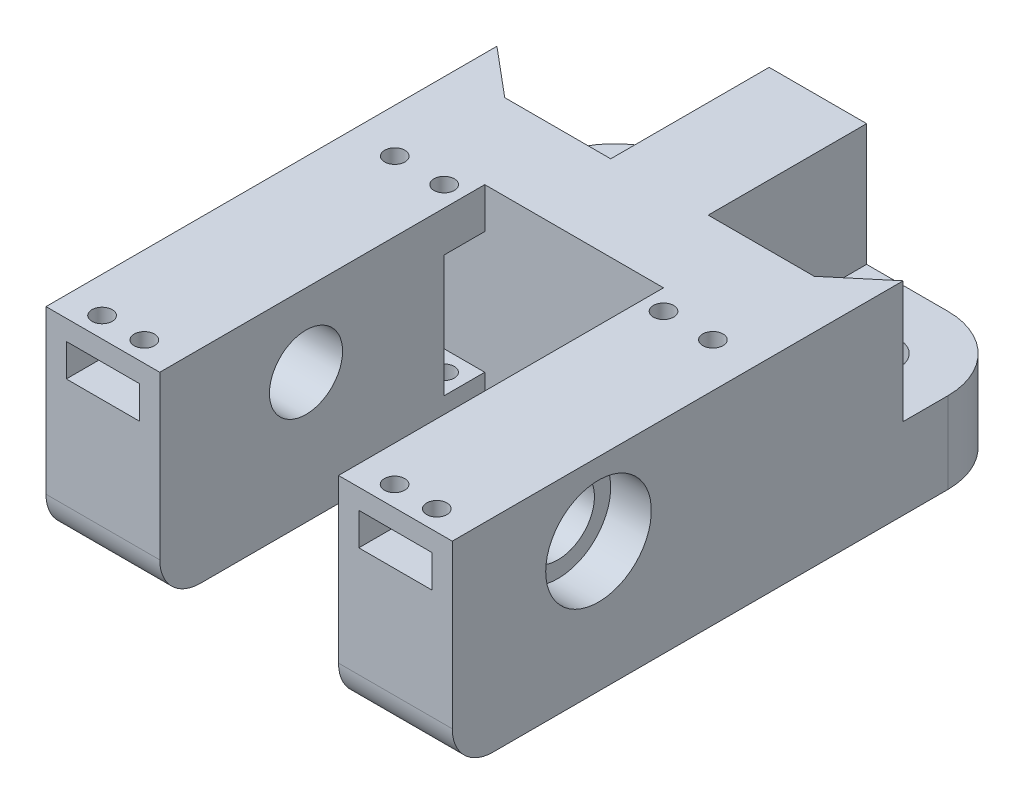
from build123d import *

# Parameters (mm, degrees)
SKETCH_1_W               = 50
SKETCH_1_H               = 25
EXTRUDE_1_DEPTH          = 70
SKETCH_2_W               = 22
SKETCH_2_H               = 25
CUT_EXTRUDE_1_DEPTH      = 40
SKETCH_3_R               = 4.5
CUT_EXTRUDE_2_DEPTH      = 50
SKETCH_4_R               = 6.5
CUT_EXTRUDE_4_DEPTH      = 5
SKETCH_5_R               = 3
CUT_EXTRUDE_5_DEPTH      = 29
CUT_EXTRUDE_6_DEPTH      = 5
CUT_EXTRUDE_6_DEPTH_BACK = 15
SKETCH_7_W               = 5
SKETCH_7_H               = 15
CUT_EXTRUDE_7_DEPTH      = 10
CUT_EXTRUDE_START        = -10
SKETCH_8_R               = 1.25
CUT_EXTRUDE_8_DEPTH      = 40
SKETCH_9_R               = 2.75
CUT_EXTRUDE_9_DEPTH      = 3
FILLET_2_R               = 5
SKETCH_10_W              = 9
SKETCH_10_H              = 4
CUT_EXTRUDE_10_DEPTH     = 5
SKETCH_12_R              = 1.25
CUT_EXTRUDE_11_DEPTH     = 10


with BuildPart() as part:
    # 스케치1 → 보스-돌출1 (new body)
    with BuildSketch(Plane.XY):
        Rectangle(SKETCH_1_W, SKETCH_1_H)
    extrude(amount=EXTRUDE_1_DEPTH)

    # 스케치2 → 컷-돌출1 (cut)
    with BuildSketch(Plane.XY.offset(70)):
        Rectangle(SKETCH_2_W, SKETCH_2_H)
    extrude(amount=-CUT_EXTRUDE_1_DEPTH, mode=Mode.SUBTRACT)

    # 스케치3 → 컷-돌출2 (cut)
    with BuildSketch(Plane(origin=(25, 0, 0), x_dir=(0, 0, -1), z_dir=(1, 0, 0))):
        with Locations((-52, 3.5)):
            Circle(SKETCH_3_R)
    extrude(amount=-CUT_EXTRUDE_2_DEPTH, mode=Mode.SUBTRACT)

    # 스케치4 → 컷-돌출4 (cut)
    with BuildSketch(Plane.ZY.offset(-25)):
        with Locations((52, 3.5)):
            Circle(SKETCH_4_R)
    cut_extrude_4 = extrude(amount=CUT_EXTRUDE_4_DEPTH, mode=Mode.SUBTRACT)

    # 스케치5 → 컷-돌출5 (cut)
    with BuildSketch(Plane(origin=(0, 12.5, 0), x_dir=(1, 0, 0), z_dir=(0, 1, 0))):
        with Locations((16, -9)):
            Circle(SKETCH_5_R)
        with BuildLine():
            Line((16, 12.355747981), (16, 0))
            ThreePointArc((16, 0), (22.363961031, -2.636038969), (25, -9))
            Line((25, -9), (37.355747981, -9))
            ThreePointArc((37.355747981, -9), (31.100794214, 6.100794214), (16, 12.355747981))
        make_face()
    cut_extrude_5 = extrude(amount=-CUT_EXTRUDE_5_DEPTH, mode=Mode.SUBTRACT)

    # 대칭 복사2: 컷-돌출4, 컷-돌출5 across plane
    add(cut_extrude_4.mirror(Plane(origin=(0, 0, 0), x_dir=(0, 0, 1), z_dir=(1, 0, 0))), mode=Mode.SUBTRACT)
    add(cut_extrude_5.mirror(Plane(origin=(0, 0, 0), x_dir=(0, 0, 1), z_dir=(1, 0, 0))), mode=Mode.SUBTRACT)

    # 스케치6 → 컷-돌출6 (cut, two sides: drawn at the far end of the back side and taken through both)
    with BuildSketch(Plane(origin=(0, 12.5, 0), x_dir=(1, 0, 0), z_dir=(0, 1, 0)).offset(-CUT_EXTRUDE_6_DEPTH_BACK)):
        Polygon((6, -19.5), (6, 5.258137662), (25, 5.258137662), (25, -14.502176213), (19.043825546, -19.5), align=None)
        Polygon((-25, -14.502176213), (-25, 5.258137662), (-6, 5.258137662), (-6, -19.5), (-19.043825546, -19.5), align=None)
    extrude(amount=CUT_EXTRUDE_6_DEPTH + CUT_EXTRUDE_6_DEPTH_BACK, mode=Mode.SUBTRACT)

    # 스케치7 → 컷-돌출7 (cut)
    with BuildSketch(Plane(origin=(-11, 0, 0), x_dir=(0, 0, -1), z_dir=(1, 0, 0))):
        with Locations((-32.5, 0)):
            Rectangle(SKETCH_7_W, SKETCH_7_H)
    cut_extrude_7 = extrude(amount=-CUT_EXTRUDE_7_DEPTH, mode=Mode.SUBTRACT)

    # 스케치8 → 컷-돌출8 (cut)
    with BuildSketch(Plane(origin=(0, -7.5, 0), x_dir=(1, 0, 0), z_dir=(0, 1, 0)).offset(CUT_EXTRUDE_START)):
        with Locations((-13.5, -32.5)):
            Circle(SKETCH_8_R)
        with Locations((-19.574812365, -32.5)):
            Circle(SKETCH_8_R)
    cut_extrude_8 = extrude(amount=CUT_EXTRUDE_8_DEPTH, mode=Mode.SUBTRACT)

    # 스케치9 → 컷-돌출9 (cut)
    with BuildSketch(Plane.XZ.offset(12.5)):
        with Locations((-19.574812365, 32.5)):
            Circle(SKETCH_9_R)
        with Locations((-13.5, 32.5)):
            Circle(SKETCH_9_R)
    cut_extrude_9 = extrude(amount=-CUT_EXTRUDE_9_DEPTH, mode=Mode.SUBTRACT)

    # 필렛2
    fillet_2_edges = [part.edges().sort_by_distance(p)[0] for p in [
        (18, -12.5, 70),
        (-18, -12.5, 70),
    ]]
    fillet(fillet_2_edges, radius=FILLET_2_R)

    # 스케치10 → 컷-돌출10 (cut)
    with BuildSketch(Plane.XY.offset(70)):
        with Locations((-18, 8.036191449)):
            Rectangle(SKETCH_10_W, SKETCH_10_H)
    cut_extrude_10 = extrude(amount=-CUT_EXTRUDE_10_DEPTH, mode=Mode.SUBTRACT)

    # 스케치12 → 컷-돌출11 (cut)
    with BuildSketch(Plane.XZ.offset(-10.036191449)):
        with Locations((-15.400835213, 67.5)):
            Circle(SKETCH_12_R)
        with Locations((-20.599164787, 67.5)):
            Circle(SKETCH_12_R)
    cut_extrude_11 = extrude(amount=-CUT_EXTRUDE_11_DEPTH, mode=Mode.SUBTRACT)

    # 대칭 복사3: 컷-돌출7, 컷-돌출8, 컷-돌출9, 컷-돌출10, 컷-돌출11 across plane
    add(cut_extrude_7.mirror(Plane(origin=(0, 0, 0), x_dir=(0, 0, 1), z_dir=(1, 0, 0))), mode=Mode.SUBTRACT)
    add(cut_extrude_8.mirror(Plane(origin=(0, 0, 0), x_dir=(0, 0, 1), z_dir=(1, 0, 0))), mode=Mode.SUBTRACT)
    add(cut_extrude_9.mirror(Plane(origin=(0, 0, 0), x_dir=(0, 0, 1), z_dir=(1, 0, 0))), mode=Mode.SUBTRACT)
    add(cut_extrude_10.mirror(Plane(origin=(0, 0, 0), x_dir=(0, 0, 1), z_dir=(1, 0, 0))), mode=Mode.SUBTRACT)
    add(cut_extrude_11.mirror(Plane(origin=(0, 0, 0), x_dir=(0, 0, 1), z_dir=(1, 0, 0))), mode=Mode.SUBTRACT)


solid = part.part
